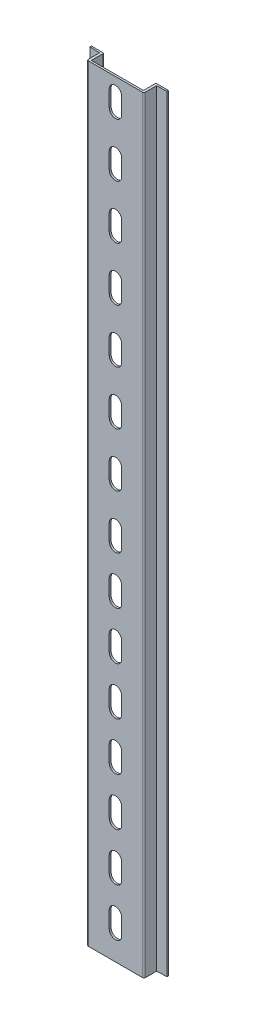
from build123d import *

# Parameters (mm, degrees)
SALIENTE_EXTRUIR1_DEPTH      = 400
SALIENTE_EXTRUIR1_DEPTH_BACK = 0.1
CORTAR_EXTRUIR4_DEPTH        = 10
CROQUIS4_W                   = 0.15
CROQUIS4_H                   = 10
CORTAR_EXTRUIR9_DEPTH        = 0.1


with BuildPart() as part:
    # Croquis1 → Saliente-Extruir1 (new, two sides: drawn at the far end of the back side and taken through both)
    with BuildSketch(Plane(origin=(0, 0, 0), x_dir=(1, 0, 0), z_dir=(0, 1, 0)).offset(-SALIENTE_EXTRUIR1_DEPTH_BACK)):
        with BuildLine():
            Line((34.919955981, -1.488391566), (40.072080634, -1.226803632))
            add(Edge.make_bspline(
                [(40.072080634, -0.488391566), (40.190854748, -0.858541724), (40.072080634, -1.226803632)],
                knots=[0, 0, 0, 1, 1, 1], degree=2))
            Line((40.072080634, -0.488391566), (34.119955981, -0.488391566))
            ThreePointArc((34.119955981, -0.488391566), (33.766402591, -0.634838176), (33.619955981, -0.988391566))
            Line((33.619955981, -0.988391566), (33.619955981, -6.714416127))
            ThreePointArc((33.619955981, -6.714416127), (33.532088016, -6.926548161), (33.319955981, -7.014416127))
            Line((33.319955981, -7.014416127), (6.752124653, -7.014416127))
            ThreePointArc((6.752124653, -7.014416127), (6.539992619, -6.926548161), (6.452124653, -6.714416127))
            Line((6.452124653, -6.714416127), (6.452124653, -0.988391566))
            ThreePointArc((6.452124653, -0.988391566), (6.305678044, -0.634838176), (5.952124653, -0.488391566))
            Line((5.952124653, -0.488391566), (0, -0.488391566))
            add(Edge.make_bspline(
                [(0, -0.488391566), (-0.118774114, -0.858541724), (0, -1.226803632)],
                knots=[0, 0, 0, 1, 1, 1], degree=2))
            Line((0, -1.226803632), (5.152124653, -1.488391566))
            Line((5.152124653, -1.488391566), (5.152124653, -7.314416127))
            ThreePointArc((5.152124653, -7.314416127), (5.357149906, -7.809390874), (5.852124653, -8.014416127))
            Line((5.852124653, -8.014416127), (34.219955981, -8.014416127))
            ThreePointArc((34.219955981, -8.014416127), (34.714930728, -7.809390874), (34.919955981, -7.314416127))
            Line((34.919955981, -7.314416127), (34.919955981, -1.488391566))
        make_face()
    extrude(amount=SALIENTE_EXTRUIR1_DEPTH + SALIENTE_EXTRUIR1_DEPTH_BACK)

    # Croquis2 → Cortar-Extruir4 (cut)
    with BuildSketch(Plane.XY.offset(8.014416127)):
        with BuildLine():
            Line((16.786040317, 38.25), (16.786040317, 46.75))
            ThreePointArc((16.786040317, 46.75), (20.036040317, 50), (23.286040317, 46.75))
            Line((23.286040317, 46.75), (23.286040317, 38.25))
            ThreePointArc((23.286040317, 38.25), (20.036040317, 35), (16.786040317, 38.25))
        make_face()
        with BuildLine():
            Line((16.786040317, 13.25), (16.786040317, 21.75))
            ThreePointArc((16.786040317, 21.75), (20.036040317, 25), (23.286040317, 21.75))
            Line((23.286040317, 21.75), (23.286040317, 13.25))
            ThreePointArc((23.286040317, 13.25), (20.036040317, 10), (16.786040317, 13.25))
        make_face()
        with BuildLine():
            Line((16.786040317, 63.25), (16.786040317, 71.75))
            ThreePointArc((16.786040317, 71.75), (20.036040317, 75), (23.286040317, 71.75))
            Line((23.286040317, 71.75), (23.286040317, 63.25))
            ThreePointArc((23.286040317, 63.25), (20.036040317, 60), (16.786040317, 63.25))
        make_face()
        with BuildLine():
            Line((16.786040317, 88.25), (16.786040317, 96.75))
            ThreePointArc((16.786040317, 96.75), (20.036040317, 100), (23.286040317, 96.75))
            Line((23.286040317, 96.75), (23.286040317, 88.25))
            ThreePointArc((23.286040317, 88.25), (20.036040317, 85), (16.786040317, 88.25))
        make_face()
        with BuildLine():
            Line((16.786040317, 113.25), (16.786040317, 121.75))
            ThreePointArc((16.786040317, 121.75), (20.036040317, 125), (23.286040317, 121.75))
            Line((23.286040317, 121.75), (23.286040317, 113.25))
            ThreePointArc((23.286040317, 113.25), (20.036040317, 110), (16.786040317, 113.25))
        make_face()
        with BuildLine():
            Line((16.786040317, 138.25), (16.786040317, 146.75))
            ThreePointArc((16.786040317, 146.75), (20.036040317, 150), (23.286040317, 146.75))
            Line((23.286040317, 146.75), (23.286040317, 138.25))
            ThreePointArc((23.286040317, 138.25), (20.036040317, 135), (16.786040317, 138.25))
        make_face()
        with BuildLine():
            Line((16.786040317, 163.25), (16.786040317, 171.75))
            ThreePointArc((16.786040317, 171.75), (20.036040317, 175), (23.286040317, 171.75))
            Line((23.286040317, 171.75), (23.286040317, 163.25))
            ThreePointArc((23.286040317, 163.25), (20.036040317, 160), (16.786040317, 163.25))
        make_face()
        with BuildLine():
            Line((16.786040317, 188.25), (16.786040317, 196.75))
            ThreePointArc((16.786040317, 196.75), (20.036040317, 200), (23.286040317, 196.75))
            Line((23.286040317, 196.75), (23.286040317, 188.25))
            ThreePointArc((23.286040317, 188.25), (20.036040317, 185), (16.786040317, 188.25))
        make_face()
        with BuildLine():
            Line((16.786040317, 216.25), (16.786040317, 224.75))
            ThreePointArc((16.786040317, 224.75), (20.036040317, 228), (23.286040317, 224.75))
            Line((23.286040317, 224.75), (23.286040317, 216.25))
            ThreePointArc((23.286040317, 216.25), (20.036040317, 213), (16.786040317, 216.25))
        make_face()
        with BuildLine():
            Line((16.786040317, 244.25), (16.786040317, 252.75))
            ThreePointArc((16.786040317, 252.75), (20.036040317, 256), (23.286040317, 252.75))
            Line((23.286040317, 252.75), (23.286040317, 244.25))
            ThreePointArc((23.286040317, 244.25), (20.036040317, 241), (16.786040317, 244.25))
        make_face()
        with BuildLine():
            Line((16.786040317, 272.25), (16.786040317, 280.75))
            ThreePointArc((16.786040317, 280.75), (20.036040317, 284), (23.286040317, 280.75))
            Line((23.286040317, 280.75), (23.286040317, 272.25))
            ThreePointArc((23.286040317, 272.25), (20.036040317, 269), (16.786040317, 272.25))
        make_face()
        with BuildLine():
            Line((16.786040317, 300.25), (16.786040317, 308.75))
            ThreePointArc((16.786040317, 308.75), (20.036040317, 312), (23.286040317, 308.75))
            Line((23.286040317, 308.75), (23.286040317, 300.25))
            ThreePointArc((23.286040317, 300.25), (20.036040317, 297), (16.786040317, 300.25))
        make_face()
        with BuildLine():
            Line((16.786040317, 328.25), (16.786040317, 336.75))
            ThreePointArc((16.786040317, 336.75), (20.036040317, 340), (23.286040317, 336.75))
            Line((23.286040317, 336.75), (23.286040317, 328.25))
            ThreePointArc((23.286040317, 328.25), (20.036040317, 325), (16.786040317, 328.25))
        make_face()
        with BuildLine():
            Line((16.786040317, 356.25), (16.786040317, 364.75))
            ThreePointArc((16.786040317, 364.75), (20.036040317, 368), (23.286040317, 364.75))
            Line((23.286040317, 364.75), (23.286040317, 356.25))
            ThreePointArc((23.286040317, 356.25), (20.036040317, 353), (16.786040317, 356.25))
        make_face()
        with BuildLine():
            Line((16.786040317, 384.25), (16.786040317, 392.75))
            ThreePointArc((16.786040317, 392.75), (20.036040317, 396), (23.286040317, 392.75))
            Line((23.286040317, 392.75), (23.286040317, 384.25))
            ThreePointArc((23.286040317, 384.25), (20.036040317, 381), (16.786040317, 384.25))
        make_face()
    extrude(amount=-CORTAR_EXTRUIR4_DEPTH, mode=Mode.SUBTRACT)

    # Croquis4 → Cortar-Extruir9 (cut)
    with BuildSketch(Plane(origin=(0, 0, 7.014416127), x_dir=(-1, 0, 0), z_dir=(0, 0, -1))):
        with Locations((-20.036040317, 29.95)):
            Rectangle(CROQUIS4_W, CROQUIS4_H)
        with Locations((-20.036040317, 4.95)):
            Rectangle(CROQUIS4_W, CROQUIS4_H)
        with Locations((-20.036040317, 54.95)):
            Rectangle(CROQUIS4_W, CROQUIS4_H)
        with Locations((-20.036040317, 79.95)):
            Rectangle(CROQUIS4_W, CROQUIS4_H)
        with Locations((-20.036040317, 104.95)):
            Rectangle(CROQUIS4_W, CROQUIS4_H)
        with Locations((-20.036040317, 129.95)):
            Rectangle(CROQUIS4_W, CROQUIS4_H)
        with Locations((-20.036040317, 154.95)):
            Rectangle(CROQUIS4_W, CROQUIS4_H)
        with Locations((-20.036040317, 179.95)):
            Rectangle(CROQUIS4_W, CROQUIS4_H)
    extrude(amount=-CORTAR_EXTRUIR9_DEPTH, mode=Mode.SUBTRACT)


solid = part.part
